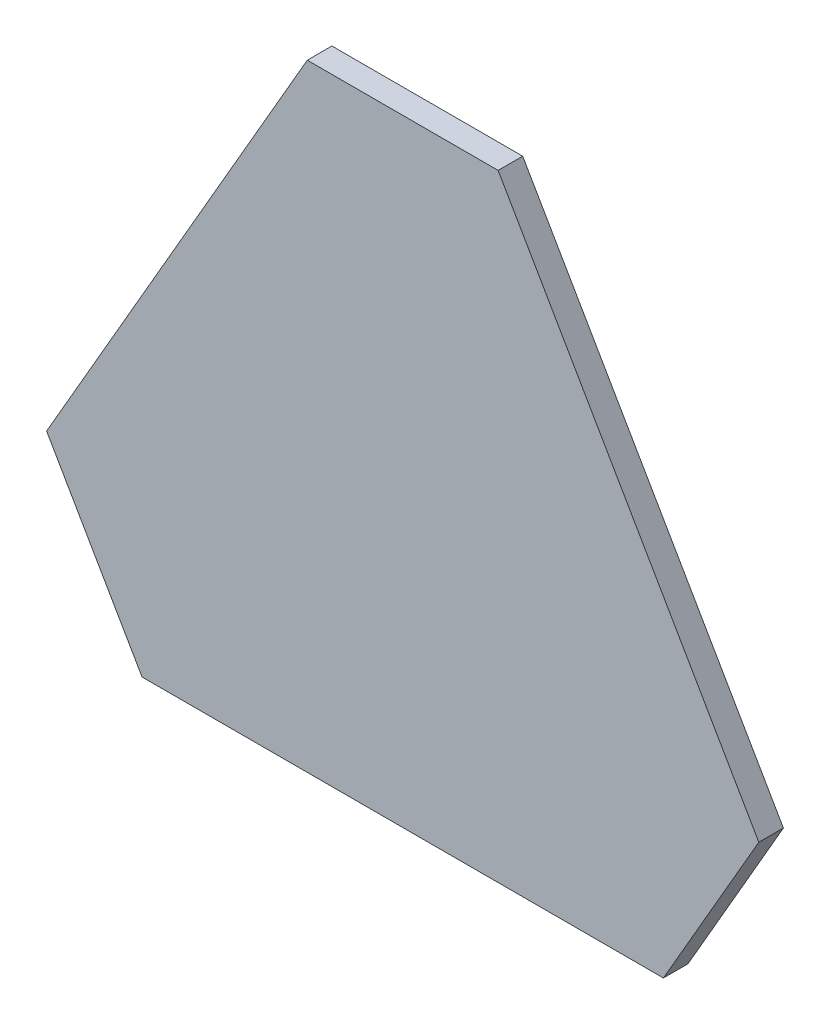
from build123d import *

# Parameters (mm, degrees)
BOSS_EXTRUDE1_DEPTH = 100


with BuildPart() as part:
    # Sketch1 → Boss-Extrude1 (new body)
    with BuildSketch(Plane(origin=(0, 0, 0), x_dir=(1, 0, 0), z_dir=(0, 0, -1))):
        Polygon((1448.888739434, 388.228567654), (388.228567654, -1448.888739434), (-388.228567654, -1448.888739434), (-1448.888739434, 388.228567654), (-1060.66017178, 1060.66017178), (1060.66017178, 1060.66017178), align=None)
    extrude(amount=BOSS_EXTRUDE1_DEPTH)


solid = part.part
